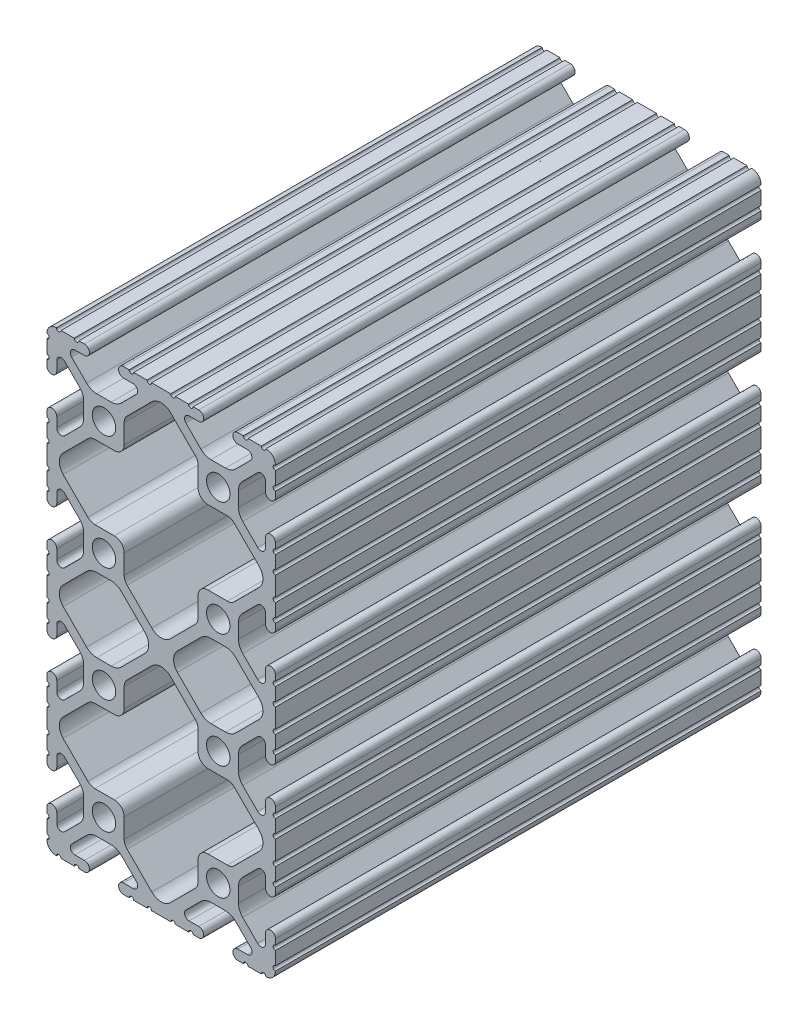
from build123d import *

# Parameters (mm, degrees)
SKETCH1_R      = 2.6035
EXTRUDE1_DEPTH = 107.95


with BuildPart() as part:
    # Sketch1 → Extrude1 (new body)
    with BuildSketch(Plane.XY):
        with BuildLine():
            Line((-12.699984366, 40.2336), (-12.699984366, 35.9664))
            ThreePointArc((-12.699984366, 35.9664), (-12.192, 35.458392183), (-12.7, 34.9504))
            Line((-12.7, 34.9504), (-12.7, 32.004))
            ThreePointArc((-12.7, 32.004), (-12.192, 31.496), (-12.7, 30.988))
            Line((-12.7, 30.988), (-12.7, 29.7434))
            ThreePointArc((-12.7, 29.7434), (-11.5951, 28.6385), (-10.4902, 29.7434))
            Line((-10.4902, 29.7434), (-10.4902, 31.874256981))
            ThreePointArc((-10.4902, 31.874256981), (-9.863010627, 32.812916821), (-8.755786031, 32.592683991))
            Line((-8.755786031, 32.592683991), (-5.425756348, 29.262714761))
            ThreePointArc((-5.425756348, 29.262714761), (-4.737487999, 28.232663563), (-4.4958, 27.017630353))
            Line((-4.4958, 27.017630353), (-4.4958, 23.782369647))
            ThreePointArc((-4.4958, 23.782369647), (-4.737487999, 22.567336437), (-5.425756348, 21.537285239))
            Line((-5.425756348, 21.537285239), (-8.755786031, 18.207316009))
            ThreePointArc((-8.755786031, 18.207316009), (-9.863010627, 17.987083179), (-10.4902, 18.925743019))
            Line((-10.4902, 18.925743019), (-10.4902, 21.0566))
            ThreePointArc((-10.4902, 21.0566), (-11.5951, 22.1615), (-12.7, 21.0566))
            Line((-12.7, 21.0566), (-12.7, 19.812))
            ThreePointArc((-12.7, 19.812), (-12.192, 19.304), (-12.7, 18.796))
            Line((-12.7, 18.796), (-12.7, 15.8496))
            ThreePointArc((-12.7, 15.8496), (-12.192, 15.341607817), (-12.699984366, 14.8336))
            Line((-12.699984366, 14.8336), (-12.699984366, 10.5664))
            ThreePointArc((-12.699984366, 10.5664), (-12.192, 10.0584), (-12.699984366, 9.5504))
            Line((-12.699984366, 9.5504), (-12.699984366, 6.604))
            ThreePointArc((-12.699984366, 6.604), (-12.192, 6.095992183), (-12.7, 5.588))
            Line((-12.7, 5.588), (-12.7, 4.3434))
            ThreePointArc((-12.7, 4.3434), (-11.5951, 3.2385), (-10.4902, 4.3434))
            Line((-10.4902, 4.3434), (-10.4902, 6.474256981))
            ThreePointArc((-10.4902, 6.474256981), (-9.863010627, 7.412916821), (-8.755786031, 7.192683991))
            Line((-8.755786031, 7.192683991), (-5.425756348, 3.862714761))
            ThreePointArc((-5.425756348, 3.862714761), (-4.737487999, 2.832663563), (-4.4958, 1.617630353))
            Line((-4.4958, 1.617630353), (-4.4958, -1.617630353))
            ThreePointArc((-4.4958, -1.617630353), (-4.737487999, -2.832663563), (-5.425756348, -3.862714761))
            Line((-5.425756348, -3.862714761), (-8.755786031, -7.192683991))
            ThreePointArc((-8.755786031, -7.192683991), (-9.863010627, -7.412916821), (-10.4902, -6.474256981))
            Line((-10.4902, -6.474256981), (-10.4902, -4.3434))
            ThreePointArc((-10.4902, -4.3434), (-11.5951, -3.2385), (-12.7, -4.3434))
            Line((-12.7, -4.3434), (-12.7, -5.588))
            ThreePointArc((-12.7, -5.588), (-12.192, -6.096), (-12.7, -6.604))
            Line((-12.7, -6.604), (-12.7, -9.5504))
            ThreePointArc((-12.7, -9.5504), (-12.192000007, -10.058315768), (-12.699831537, -10.566399972))
            ThreePointArc((-12.699831537, -10.566399972), (-12.082506882, -12.082506882), (-10.566399972, -12.699831537))
            ThreePointArc((-10.566399972, -12.699831537), (-10.058315768, -12.192000007), (-9.5504, -12.7))
            Line((-9.5504, -12.7), (-6.604, -12.7))
            ThreePointArc((-6.604, -12.7), (-6.096, -12.192), (-5.588, -12.7))
            Line((-5.588, -12.7), (-4.3434, -12.7))
            ThreePointArc((-4.3434, -12.7), (-3.2385, -11.5951), (-4.3434, -10.4902))
            Line((-4.3434, -10.4902), (-6.474256981, -10.4902))
            ThreePointArc((-6.474256981, -10.4902), (-7.412916821, -9.863010627), (-7.192683991, -8.755786031))
            Line((-7.192683991, -8.755786031), (-3.862714761, -5.425756348))
            ThreePointArc((-3.862714761, -5.425756348), (-2.832663563, -4.737487999), (-1.617630353, -4.4958))
            Line((-1.617630353, -4.4958), (1.617630353, -4.4958))
            ThreePointArc((1.617630353, -4.4958), (2.832663563, -4.737487999), (3.862714761, -5.425756348))
            Line((3.862714761, -5.425756348), (7.192683991, -8.755786031))
            ThreePointArc((7.192683991, -8.755786031), (7.412916821, -9.863010627), (6.474256981, -10.4902))
            Line((6.474256981, -10.4902), (4.3434, -10.4902))
            ThreePointArc((4.3434, -10.4902), (3.2385, -11.5951), (4.3434, -12.7))
            Line((4.3434, -12.7), (5.588, -12.7))
            ThreePointArc((5.588, -12.7), (6.096, -12.192), (6.604, -12.7))
            Line((6.604, -12.7), (9.5504, -12.7))
            ThreePointArc((9.5504, -12.7), (10.0584, -12.192), (10.5664, -12.7))
            Line((10.5664, -12.7), (14.8336, -12.7))
            ThreePointArc((14.8336, -12.7), (15.3416, -12.192), (15.8496, -12.7))
            Line((15.8496, -12.7), (18.796, -12.7))
            ThreePointArc((18.796, -12.7), (19.304, -12.192), (19.812, -12.7))
            Line((19.812, -12.7), (21.0566, -12.7))
            ThreePointArc((21.0566, -12.7), (22.1615, -11.5951), (21.0566, -10.4902))
            Line((21.0566, -10.4902), (18.925743019, -10.4902))
            ThreePointArc((18.925743019, -10.4902), (17.987083179, -9.863010627), (18.207316009, -8.755786031))
            Line((18.207316009, -8.755786031), (21.537285239, -5.425756348))
            ThreePointArc((21.537285239, -5.425756348), (22.567336437, -4.737487999), (23.782369647, -4.4958))
            Line((23.782369647, -4.4958), (27.017630353, -4.4958))
            ThreePointArc((27.017630353, -4.4958), (28.232663563, -4.737487999), (29.262714761, -5.425756348))
            Line((29.262714761, -5.425756348), (32.592683991, -8.755786031))
            ThreePointArc((32.592683991, -8.755786031), (32.812916821, -9.863010627), (31.874256981, -10.4902))
            Line((31.874256981, -10.4902), (29.7434, -10.4902))
            ThreePointArc((29.7434, -10.4902), (28.6385, -11.5951), (29.7434, -12.7))
            Line((29.7434, -12.7), (30.988, -12.7))
            ThreePointArc((30.988, -12.7), (31.496, -12.192), (32.004, -12.7))
            Line((32.004, -12.7), (34.9504, -12.7))
            ThreePointArc((34.9504, -12.7), (35.458315768, -12.192000007), (35.966399972, -12.699831537))
            ThreePointArc((35.966399972, -12.699831537), (37.482506882, -12.082506882), (38.099831537, -10.566399972))
            ThreePointArc((38.099831537, -10.566399972), (37.592000007, -10.058315768), (38.1, -9.5504))
            Line((38.1, -9.5504), (38.1, -6.604))
            ThreePointArc((38.1, -6.604), (37.592, -6.096), (38.1, -5.588))
            Line((38.1, -5.588), (38.1, -4.3434))
            ThreePointArc((38.1, -4.3434), (36.9951, -3.2385), (35.8902, -4.3434))
            Line((35.8902, -4.3434), (35.8902, -6.474256981))
            ThreePointArc((35.8902, -6.474256981), (35.263010627, -7.412916821), (34.155786031, -7.192683991))
            Line((34.155786031, -7.192683991), (30.825756348, -3.862714761))
            ThreePointArc((30.825756348, -3.862714761), (30.137487999, -2.832663563), (29.8958, -1.617630353))
            Line((29.8958, -1.617630353), (29.8958, 1.617630353))
            ThreePointArc((29.8958, 1.617630353), (30.137487999, 2.832663563), (30.825756348, 3.862714761))
            Line((30.825756348, 3.862714761), (34.155786031, 7.192683991))
            ThreePointArc((34.155786031, 7.192683991), (35.263010627, 7.412916821), (35.8902, 6.474256981))
            Line((35.8902, 6.474256981), (35.8902, 4.3434))
            ThreePointArc((35.8902, 4.3434), (36.9951, 3.2385), (38.1, 4.3434))
            Line((38.1, 4.3434), (38.1, 5.588))
            ThreePointArc((38.1, 5.588), (37.592, 6.096), (38.1, 6.604))
            Line((38.1, 6.604), (38.1, 9.5504))
            ThreePointArc((38.1, 9.5504), (37.592, 10.058392183), (38.099984366, 10.5664))
            Line((38.099984366, 10.5664), (38.099984366, 14.8336))
            ThreePointArc((38.099984366, 14.8336), (37.592, 15.3416), (38.099984366, 15.8496))
            Line((38.099984366, 15.8496), (38.099984366, 18.796))
            ThreePointArc((38.099984366, 18.796), (37.592, 19.304007817), (38.1, 19.812))
            Line((38.1, 19.812), (38.1, 21.0566))
            ThreePointArc((38.1, 21.0566), (36.9951, 22.1615), (35.8902, 21.0566))
            Line((35.8902, 21.0566), (35.8902, 18.925743019))
            ThreePointArc((35.8902, 18.925743019), (35.263010627, 17.987083179), (34.155786031, 18.207316009))
            Line((34.155786031, 18.207316009), (30.825756348, 21.537285239))
            ThreePointArc((30.825756348, 21.537285239), (30.137487999, 22.567336437), (29.8958, 23.782369647))
            Line((29.8958, 23.782369647), (29.8958, 27.017630353))
            ThreePointArc((29.8958, 27.017630353), (30.137487999, 28.232663563), (30.825756348, 29.262714761))
            Line((30.825756348, 29.262714761), (34.155786031, 32.592683991))
            ThreePointArc((34.155786031, 32.592683991), (35.263010627, 32.812916821), (35.8902, 31.874256981))
            Line((35.8902, 31.874256981), (35.8902, 29.7434))
            ThreePointArc((35.8902, 29.7434), (36.9951, 28.6385), (38.1, 29.7434))
            Line((38.1, 29.7434), (38.1, 30.988))
            ThreePointArc((38.1, 30.988), (37.592, 31.495992183), (38.099984366, 32.004))
            Line((38.099984366, 32.004), (38.099984366, 34.9504))
            ThreePointArc((38.099984366, 34.9504), (37.592, 35.4584), (38.099984366, 35.9664))
            Line((38.099984366, 35.9664), (38.099984366, 40.2336))
            ThreePointArc((38.099984366, 40.2336), (37.592, 40.7416), (38.099984366, 41.2496))
            Line((38.099984366, 41.2496), (38.099984366, 44.196))
            ThreePointArc((38.099984366, 44.196), (37.592, 44.704007817), (38.1, 45.212))
            Line((38.1, 45.212), (38.1, 46.4566))
            ThreePointArc((38.1, 46.4566), (36.9951, 47.5615), (35.8902, 46.4566))
            Line((35.8902, 46.4566), (35.8902, 44.325743019))
            ThreePointArc((35.8902, 44.325743019), (35.263010627, 43.387083179), (34.155786031, 43.607316009))
            Line((34.155786031, 43.607316009), (30.825756348, 46.937285239))
            ThreePointArc((30.825756348, 46.937285239), (30.137487999, 47.967336437), (29.8958, 49.182369647))
            Line((29.8958, 49.182369647), (29.8958, 52.417630353))
            ThreePointArc((29.8958, 52.417630353), (30.137487999, 53.632663563), (30.825756348, 54.662714761))
            Line((30.825756348, 54.662714761), (34.155786031, 57.992683991))
            ThreePointArc((34.155786031, 57.992683991), (35.263010627, 58.212916821), (35.8902, 57.274256981))
            Line((35.8902, 57.274256981), (35.8902, 55.1434))
            ThreePointArc((35.8902, 55.1434), (36.9951, 54.0385), (38.1, 55.1434))
            Line((38.1, 55.1434), (38.1, 56.388))
            ThreePointArc((38.1, 56.388), (37.592, 56.896), (38.1, 57.404))
            Line((38.1, 57.404), (38.1, 60.3504))
            ThreePointArc((38.1, 60.3504), (37.592, 60.858392183), (38.099984366, 61.3664))
            Line((38.099984366, 61.3664), (38.099984366, 65.6336))
            ThreePointArc((38.099984366, 65.6336), (37.592, 66.141607817), (38.1, 66.6496))
            Line((38.1, 66.6496), (38.1, 69.596))
            ThreePointArc((38.1, 69.596), (37.592, 70.104), (38.1, 70.612))
            Line((38.1, 70.612), (38.1, 71.8566))
            ThreePointArc((38.1, 71.8566), (36.9951, 72.9615), (35.8902, 71.8566))
            Line((35.8902, 71.8566), (35.8902, 69.725743019))
            ThreePointArc((35.8902, 69.725743019), (35.263010627, 68.787083179), (34.155786031, 69.007316009))
            Line((34.155786031, 69.007316009), (30.825756348, 72.337285239))
            ThreePointArc((30.825756348, 72.337285239), (30.137487999, 73.367336437), (29.8958, 74.582369647))
            Line((29.8958, 74.582369647), (29.8958, 77.817630353))
            ThreePointArc((29.8958, 77.817630353), (30.137487999, 79.032663563), (30.825756348, 80.062714761))
            Line((30.825756348, 80.062714761), (34.155786031, 83.392683991))
            ThreePointArc((34.155786031, 83.392683991), (35.263010627, 83.612916821), (35.8902, 82.674256981))
            Line((35.8902, 82.674256981), (35.8902, 80.5434))
            ThreePointArc((35.8902, 80.5434), (36.9951, 79.4385), (38.1, 80.5434))
            Line((38.1, 80.5434), (38.1, 81.788))
            ThreePointArc((38.1, 81.788), (37.592, 82.296), (38.1, 82.804))
            Line((38.1, 82.804), (38.1, 85.7504))
            ThreePointArc((38.1, 85.7504), (37.592000007, 86.258315768), (38.099831537, 86.766399972))
            ThreePointArc((38.099831537, 86.766399972), (37.482506882, 88.282506882), (35.966399972, 88.899831537))
            ThreePointArc((35.966399972, 88.899831537), (35.458315768, 88.392000007), (34.9504, 88.9))
            Line((34.9504, 88.9), (32.004, 88.9))
            ThreePointArc((32.004, 88.9), (31.496, 88.392), (30.988, 88.9))
            Line((30.988, 88.9), (29.7434, 88.9))
            ThreePointArc((29.7434, 88.9), (28.6385, 87.7951), (29.7434, 86.6902))
            Line((29.7434, 86.6902), (31.874256981, 86.6902))
            ThreePointArc((31.874256981, 86.6902), (32.812916821, 86.063010627), (32.592683991, 84.955786031))
            Line((32.592683991, 84.955786031), (29.262714761, 81.625756348))
            ThreePointArc((29.262714761, 81.625756348), (28.232663563, 80.937487999), (27.017630353, 80.6958))
            Line((27.017630353, 80.6958), (23.782369647, 80.6958))
            ThreePointArc((23.782369647, 80.6958), (22.567336437, 80.937487999), (21.537285239, 81.625756348))
            Line((21.537285239, 81.625756348), (18.207316009, 84.955786031))
            ThreePointArc((18.207316009, 84.955786031), (17.987083179, 86.063010627), (18.925743019, 86.6902))
            Line((18.925743019, 86.6902), (21.0566, 86.6902))
            ThreePointArc((21.0566, 86.6902), (22.1615, 87.7951), (21.0566, 88.9))
            Line((21.0566, 88.9), (19.812, 88.9))
            ThreePointArc((19.812, 88.9), (19.304, 88.392), (18.796, 88.9))
            Line((18.796, 88.9), (15.8496, 88.9))
            ThreePointArc((15.8496, 88.9), (15.3416, 88.392), (14.8336, 88.9))
            Line((14.8336, 88.9), (10.5664, 88.9))
            ThreePointArc((10.5664, 88.9), (10.0584, 88.392), (9.5504, 88.9))
            Line((9.5504, 88.9), (6.604, 88.9))
            ThreePointArc((6.604, 88.9), (6.096, 88.392), (5.588, 88.9))
            Line((5.588, 88.9), (4.3434, 88.9))
            ThreePointArc((4.3434, 88.9), (3.2385, 87.7951), (4.3434, 86.6902))
            Line((4.3434, 86.6902), (6.474256981, 86.6902))
            ThreePointArc((6.474256981, 86.6902), (7.412916821, 86.063010627), (7.192683991, 84.955786031))
            Line((7.192683991, 84.955786031), (3.862714761, 81.625756348))
            ThreePointArc((3.862714761, 81.625756348), (2.832663563, 80.937487999), (1.617630353, 80.6958))
            Line((1.617630353, 80.6958), (-1.617630353, 80.6958))
            ThreePointArc((-1.617630353, 80.6958), (-2.832663563, 80.937487999), (-3.862714761, 81.625756348))
            Line((-3.862714761, 81.625756348), (-7.192683991, 84.955786031))
            ThreePointArc((-7.192683991, 84.955786031), (-7.412916821, 86.063010627), (-6.474256981, 86.6902))
            Line((-6.474256981, 86.6902), (-4.3434, 86.6902))
            ThreePointArc((-4.3434, 86.6902), (-3.2385, 87.7951), (-4.3434, 88.9))
            Line((-4.3434, 88.9), (-5.588, 88.9))
            ThreePointArc((-5.588, 88.9), (-6.096, 88.392), (-6.604, 88.9))
            Line((-6.604, 88.9), (-9.5504, 88.9))
            ThreePointArc((-9.5504, 88.9), (-10.058315768, 88.392000007), (-10.566399972, 88.899831537))
            ThreePointArc((-10.566399972, 88.899831537), (-12.082506882, 88.282506882), (-12.699831537, 86.766399972))
            ThreePointArc((-12.699831537, 86.766399972), (-12.192000007, 86.258315768), (-12.7, 85.7504))
            Line((-12.7, 85.7504), (-12.7, 82.804))
            ThreePointArc((-12.7, 82.804), (-12.192, 82.296), (-12.7, 81.788))
            Line((-12.7, 81.788), (-12.7, 80.5434))
            ThreePointArc((-12.7, 80.5434), (-11.5951, 79.4385), (-10.4902, 80.5434))
            Line((-10.4902, 80.5434), (-10.4902, 82.674256981))
            ThreePointArc((-10.4902, 82.674256981), (-9.863010627, 83.612916821), (-8.755786031, 83.392683991))
            Line((-8.755786031, 83.392683991), (-5.425756348, 80.062714761))
            ThreePointArc((-5.425756348, 80.062714761), (-4.737487999, 79.032663563), (-4.4958, 77.817630353))
            Line((-4.4958, 77.817630353), (-4.4958, 74.582369647))
            ThreePointArc((-4.4958, 74.582369647), (-4.737487999, 73.367336437), (-5.425756348, 72.337285239))
            Line((-5.425756348, 72.337285239), (-8.755786031, 69.007316009))
            ThreePointArc((-8.755786031, 69.007316009), (-9.863010627, 68.787083179), (-10.4902, 69.725743019))
            Line((-10.4902, 69.725743019), (-10.4902, 71.8566))
            ThreePointArc((-10.4902, 71.8566), (-11.5951, 72.9615), (-12.7, 71.8566))
            Line((-12.7, 71.8566), (-12.7, 70.612))
            ThreePointArc((-12.7, 70.612), (-12.192, 70.104), (-12.7, 69.596))
            Line((-12.7, 69.596), (-12.7, 66.6496))
            ThreePointArc((-12.7, 66.6496), (-12.192, 66.141607817), (-12.699984366, 65.6336))
            Line((-12.699984366, 65.6336), (-12.699984366, 61.3664))
            ThreePointArc((-12.699984366, 61.3664), (-12.192, 60.858392183), (-12.7, 60.3504))
            Line((-12.7, 60.3504), (-12.7, 57.404))
            ThreePointArc((-12.7, 57.404), (-12.192, 56.896), (-12.7, 56.388))
            Line((-12.7, 56.388), (-12.7, 55.1434))
            ThreePointArc((-12.7, 55.1434), (-11.5951, 54.0385), (-10.4902, 55.1434))
            Line((-10.4902, 55.1434), (-10.4902, 57.274256981))
            ThreePointArc((-10.4902, 57.274256981), (-9.863010627, 58.212916821), (-8.755786031, 57.992683991))
            Line((-8.755786031, 57.992683991), (-5.425756348, 54.662714761))
            ThreePointArc((-5.425756348, 54.662714761), (-4.737487999, 53.632663563), (-4.4958, 52.417630353))
            Line((-4.4958, 52.417630353), (-4.4958, 49.182369647))
            ThreePointArc((-4.4958, 49.182369647), (-4.737487999, 47.967336437), (-5.425756348, 46.937285239))
            Line((-5.425756348, 46.937285239), (-8.755786031, 43.607316009))
            ThreePointArc((-8.755786031, 43.607316009), (-9.863010627, 43.387083179), (-10.4902, 44.325743019))
            Line((-10.4902, 44.325743019), (-10.4902, 46.4566))
            ThreePointArc((-10.4902, 46.4566), (-11.5951, 47.5615), (-12.7, 46.4566))
            Line((-12.7, 46.4566), (-12.7, 45.212))
            ThreePointArc((-12.7, 45.212), (-12.192, 44.704), (-12.7, 44.196))
            Line((-12.7, 44.196), (-12.7, 41.2496))
            ThreePointArc((-12.7, 41.2496), (-12.192, 40.741607817), (-12.699984366, 40.2336))
        make_face()
        with Locations((25.4, 76.2)):
            Circle(SKETCH1_R, mode=Mode.SUBTRACT)
        with Locations((0, 76.2)):
            Circle(SKETCH1_R, mode=Mode.SUBTRACT)
        with Locations((25.4, 50.8)):
            Circle(SKETCH1_R, mode=Mode.SUBTRACT)
        with Locations((0, 50.8)):
            Circle(SKETCH1_R, mode=Mode.SUBTRACT)
        with Locations((25.4, 0)):
            Circle(SKETCH1_R, mode=Mode.SUBTRACT)
        Circle(SKETCH1_R, mode=Mode.SUBTRACT)
        with Locations((25.4, 25.4)):
            Circle(SKETCH1_R, mode=Mode.SUBTRACT)
        with Locations((0, 25.4)):
            Circle(SKETCH1_R, mode=Mode.SUBTRACT)
        with BuildLine():
            Line((2.286, 55.2958), (-2.018378203, 55.2958))
            ThreePointArc((-2.018378203, 55.2958), (-2.864022786, 55.464007171), (-3.580928584, 55.943021252))
            Line((-3.580928584, 55.943021252), (-9.072529371, 61.434522344))
            ThreePointArc((-9.072529371, 61.434522344), (-9.928089211, 63.5), (-9.072529371, 65.565477656))
            Line((-9.072529371, 65.565477656), (-3.580928584, 71.056978748))
            ThreePointArc((-3.580928584, 71.056978748), (-2.864022786, 71.535992829), (-2.018378203, 71.7042))
            Line((-2.018378203, 71.7042), (2.286, 71.7042))
            ThreePointArc((2.286, 71.7042), (3.848564565, 72.351435435), (4.4958, 73.914))
            Line((4.4958, 73.914), (4.4958, 78.218378203))
            ThreePointArc((4.4958, 78.218378203), (4.664007171, 79.064022786), (5.143021252, 79.780928584))
            Line((5.143021252, 79.780928584), (10.634522344, 85.272529371))
            ThreePointArc((10.634522344, 85.272529371), (12.7, 86.128089211), (14.765477656, 85.272529371))
            Line((14.765477656, 85.272529371), (20.256978748, 79.780928584))
            ThreePointArc((20.256978748, 79.780928584), (20.735992829, 79.064022786), (20.9042, 78.218378203))
            Line((20.9042, 78.218378203), (20.9042, 73.914))
            ThreePointArc((20.9042, 73.914), (21.551435435, 72.351435435), (23.114, 71.7042))
            Line((23.114, 71.7042), (27.418378203, 71.7042))
            ThreePointArc((27.418378203, 71.7042), (28.264022786, 71.535992829), (28.980928584, 71.056978748))
            Line((28.980928584, 71.056978748), (34.472529371, 65.565477656))
            ThreePointArc((34.472529371, 65.565477656), (35.328089211, 63.5), (34.472529371, 61.434522344))
            Line((34.472529371, 61.434522344), (28.980928584, 55.943021252))
            ThreePointArc((28.980928584, 55.943021252), (28.264022786, 55.464007171), (27.418378203, 55.2958))
            Line((27.418378203, 55.2958), (23.114, 55.2958))
            ThreePointArc((23.114, 55.2958), (21.551435435, 54.648564565), (20.9042, 53.086))
            Line((20.9042, 53.086), (20.9042, 48.781621797))
            ThreePointArc((20.9042, 48.781621797), (20.735992829, 47.935977214), (20.256978748, 47.219071416))
            Line((20.256978748, 47.219071416), (14.765477656, 41.727470629))
            ThreePointArc((14.765477656, 41.727470629), (12.7, 40.871910789), (10.634522344, 41.727470629))
            Line((10.634522344, 41.727470629), (5.143021252, 47.219071416))
            ThreePointArc((5.143021252, 47.219071416), (4.664007171, 47.935977214), (4.4958, 48.781621797))
            Line((4.4958, 48.781621797), (4.4958, 53.086))
            ThreePointArc((4.4958, 53.086), (3.848564565, 54.648564565), (2.286, 55.2958))
        make_face(mode=Mode.SUBTRACT)
        with BuildLine():
            Line((4.4958, 23.114), (4.4958, 27.418378203))
            ThreePointArc((4.4958, 27.418378203), (4.664007171, 28.264022786), (5.143021252, 28.980928584))
            Line((5.143021252, 28.980928584), (10.634522344, 34.472529371))
            ThreePointArc((10.634522344, 34.472529371), (12.7, 35.328089211), (14.765477656, 34.472529371))
            Line((14.765477656, 34.472529371), (20.256978748, 28.980928584))
            ThreePointArc((20.256978748, 28.980928584), (20.735992829, 28.264022786), (20.9042, 27.418378203))
            Line((20.9042, 27.418378203), (20.9042, 23.114))
            ThreePointArc((20.9042, 23.114), (21.551435435, 21.551435435), (23.114, 20.9042))
            Line((23.114, 20.9042), (27.418378203, 20.9042))
            ThreePointArc((27.418378203, 20.9042), (28.264022786, 20.735992829), (28.980928584, 20.256978748))
            Line((28.980928584, 20.256978748), (34.472529371, 14.765477656))
            ThreePointArc((34.472529371, 14.765477656), (35.328089211, 12.7), (34.472529371, 10.634522344))
            Line((34.472529371, 10.634522344), (28.980928584, 5.143021252))
            ThreePointArc((28.980928584, 5.143021252), (28.264022786, 4.664007171), (27.418378203, 4.4958))
            Line((27.418378203, 4.4958), (23.114, 4.4958))
            ThreePointArc((23.114, 4.4958), (21.551435435, 3.848564565), (20.9042, 2.286))
            Line((20.9042, 2.286), (20.9042, -2.018378203))
            ThreePointArc((20.9042, -2.018378203), (20.735992829, -2.864022786), (20.256978748, -3.580928584))
            Line((20.256978748, -3.580928584), (14.765477656, -9.072529371))
            ThreePointArc((14.765477656, -9.072529371), (12.7, -9.928089211), (10.634522344, -9.072529371))
            Line((10.634522344, -9.072529371), (5.143021252, -3.580928584))
            ThreePointArc((5.143021252, -3.580928584), (4.664007171, -2.864022786), (4.4958, -2.018378203))
            Line((4.4958, -2.018378203), (4.4958, 2.286))
            ThreePointArc((4.4958, 2.286), (3.848564565, 3.848564565), (2.286, 4.4958))
            Line((2.286, 4.4958), (-2.018378203, 4.4958))
            ThreePointArc((-2.018378203, 4.4958), (-2.864022786, 4.664007171), (-3.580928584, 5.143021252))
            Line((-3.580928584, 5.143021252), (-9.072529371, 10.634522344))
            ThreePointArc((-9.072529371, 10.634522344), (-9.928089211, 12.7), (-9.072529371, 14.765477656))
            Line((-9.072529371, 14.765477656), (-3.580928584, 20.256978748))
            ThreePointArc((-3.580928584, 20.256978748), (-2.864022786, 20.735992829), (-2.018378203, 20.9042))
            Line((-2.018378203, 20.9042), (2.286, 20.9042))
            ThreePointArc((2.286, 20.9042), (3.848564565, 21.551435435), (4.4958, 23.114))
        make_face(mode=Mode.SUBTRACT)
        with BuildLine():
            Line((27.018584404, 29.8958), (23.782369647, 29.8958))
            ThreePointArc((23.782369647, 29.8958), (22.567336437, 30.137487999), (21.537285239, 30.825756348))
            Line((21.537285239, 30.825756348), (16.328576307, 36.03455984))
            ThreePointArc((16.328576307, 36.03455984), (15.473053963, 38.1), (16.328576307, 40.16544016))
            Line((16.328576307, 40.16544016), (21.537285239, 45.374243652))
            ThreePointArc((21.537285239, 45.374243652), (22.567336437, 46.062512001), (23.782369647, 46.3042))
            Line((23.782369647, 46.3042), (27.018584404, 46.3042))
            ThreePointArc((27.018584404, 46.3042), (28.233590989, 46.06252303), (29.263628056, 45.374284409))
            Line((29.263628056, 45.374284409), (34.472529371, 40.165477656))
            ThreePointArc((34.472529371, 40.165477656), (35.328089211, 38.1), (34.472529371, 36.034522344))
            Line((34.472529371, 36.034522344), (29.263628056, 30.825715591))
            ThreePointArc((29.263628056, 30.825715591), (28.233590989, 30.13747697), (27.018584404, 29.8958))
        make_face(mode=Mode.SUBTRACT)
        with BuildLine():
            Line((1.617630353, 29.8958), (-1.618584404, 29.8958))
            ThreePointArc((-1.618584404, 29.8958), (-2.833590989, 30.13747697), (-3.863628056, 30.825715591))
            Line((-3.863628056, 30.825715591), (-9.072529371, 36.034522344))
            ThreePointArc((-9.072529371, 36.034522344), (-9.928089211, 38.1), (-9.072529371, 40.165477656))
            Line((-9.072529371, 40.165477656), (-3.863628056, 45.374284409))
            ThreePointArc((-3.863628056, 45.374284409), (-2.833590989, 46.06252303), (-1.618584404, 46.3042))
            Line((-1.618584404, 46.3042), (1.617630353, 46.3042))
            ThreePointArc((1.617630353, 46.3042), (2.832663563, 46.062512001), (3.862714761, 45.374243652))
            Line((3.862714761, 45.374243652), (9.071423693, 40.16544016))
            ThreePointArc((9.071423693, 40.16544016), (9.926946037, 38.1), (9.071423693, 36.03455984))
            Line((9.071423693, 36.03455984), (3.862714761, 30.825756348))
            ThreePointArc((3.862714761, 30.825756348), (2.832663563, 30.137487999), (1.617630353, 29.8958))
        make_face(mode=Mode.SUBTRACT)
    extrude(amount=-EXTRUDE1_DEPTH)


solid = part.part
